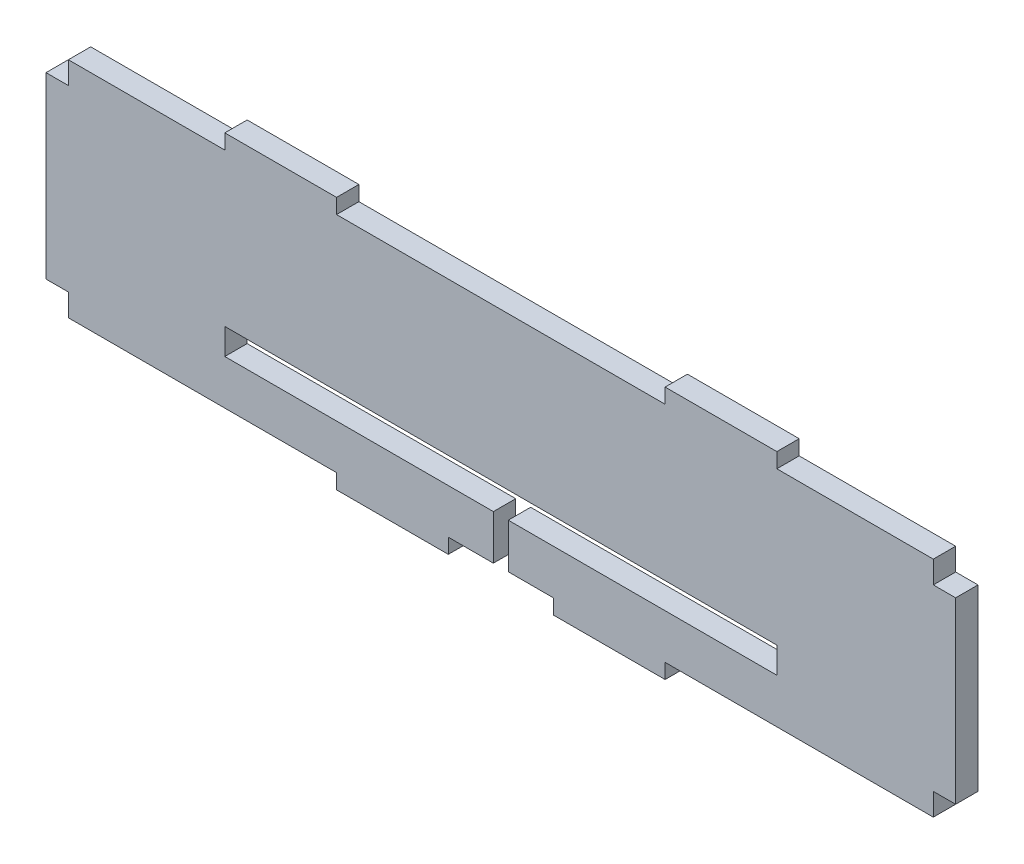
from build123d import *

# Parameters (mm, degrees)
BOSS_EXTRUDE3_DEPTH = 3


with BuildPart() as part:
    # Sketch1 → Boss-Extrude3 (new body)
    with BuildSketch(Plane.XY):
        Polygon((6, 3), (6, 0), (42, 0), (42, -2), (57, -2), (57, 0), (63.05, 0), (63.05, 6), (27, 6), (27, 9.5), (101.1, 9.5), (101.1, 6), (65.05, 6), (65.05, 0), (71.1, 0), (71.1, -2), (86.1, -2), (86.1, 0), (122.1, 0), (122.1, 3), (125.1, 3), (125.1, 27), (122.1, 27), (122.1, 30), (101.1, 30), (101.1, 32), (86.1, 32), (86.1, 30), (42, 30), (42, 32), (27, 32), (27, 30), (6, 30), (6, 27), (3, 27), (3, 3), align=None)
    extrude(amount=BOSS_EXTRUDE3_DEPTH)


solid = part.part
